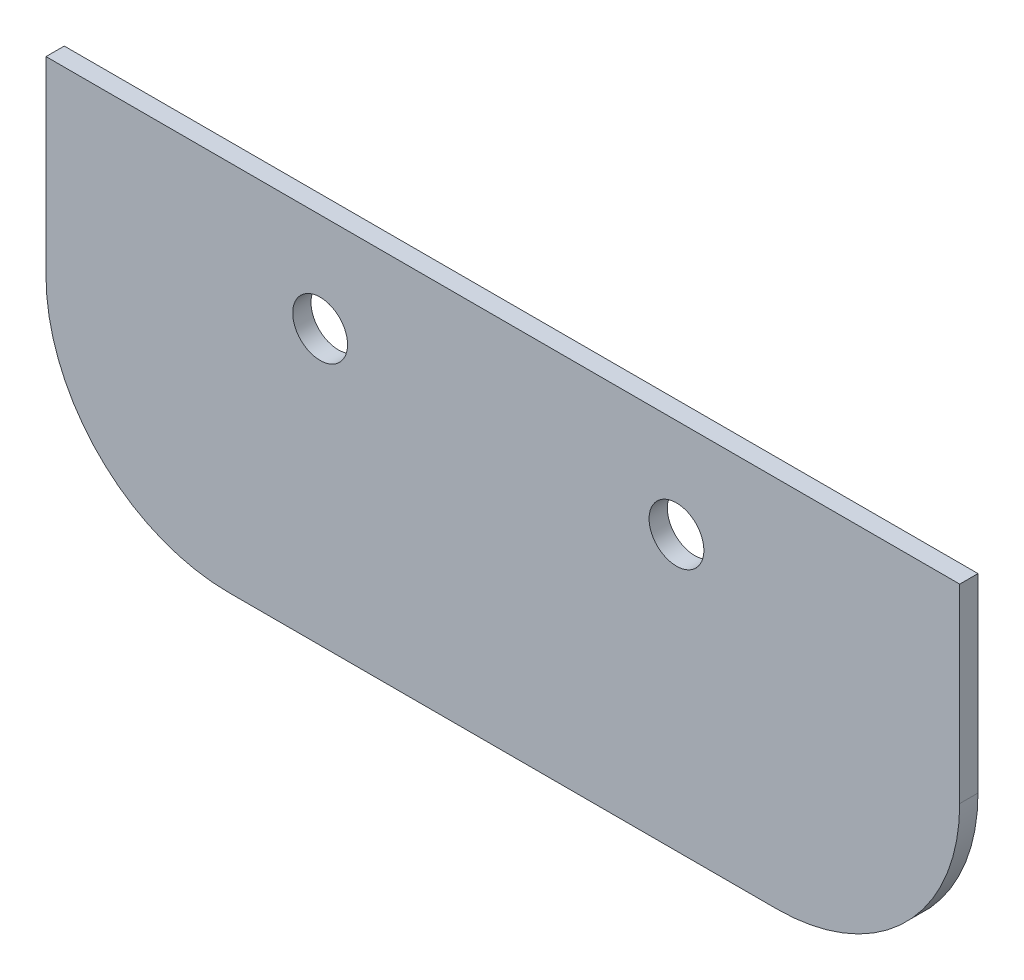
from build123d import *

# Parameters (mm, degrees)
SKETCH1_W           = 50
SKETCH1_H           = 20.400620127
SKETCH1_R           = 1.5
BOSS_EXTRUDE1_DEPTH = 1
FILLET3_R           = 10
FILLET5_R           = 10


with BuildPart() as part:
    # Sketch1 → Boss-Extrude1 (new body)
    with BuildSketch(Plane.XY):
        with Locations((25, 10.200310063)):
            Rectangle(SKETCH1_W, SKETCH1_H)
        with Locations((15, 15)):
            Circle(SKETCH1_R, mode=Mode.SUBTRACT)
        with Locations((34.5, 15)):
            Circle(SKETCH1_R, mode=Mode.SUBTRACT)
    extrude(amount=BOSS_EXTRUDE1_DEPTH)

    # Fillet3
    fillet3_edges = [part.edges().sort_by_distance(p)[0] for p in [
        (0, 0, 0.5),
    ]]
    fillet(fillet3_edges, radius=FILLET3_R)

    # Fillet5
    fillet5_edges = [part.edges().sort_by_distance(p)[0] for p in [
        (50, 0, 0.5),
    ]]
    fillet(fillet5_edges, radius=FILLET5_R)


solid = part.part
